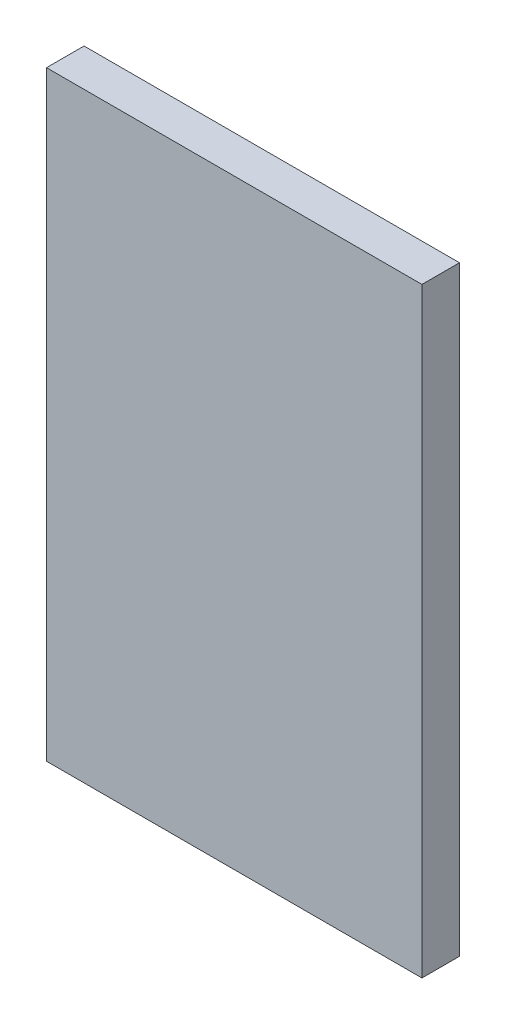
from build123d import *

# Parameters (mm, degrees)
SKETCH1_W           = 31.75
SKETCH1_H           = 3.175
BOSS_EXTRUDE1_DEPTH = 50.8


with BuildPart() as part:
    # Sketch1 → Boss-Extrude1 (new body)
    with BuildSketch(Plane(origin=(0, 0, 0), x_dir=(1, 0, 0), z_dir=(0, 1, 0))):
        Rectangle(SKETCH1_W, SKETCH1_H)
    extrude(amount=BOSS_EXTRUDE1_DEPTH)


solid = part.part
